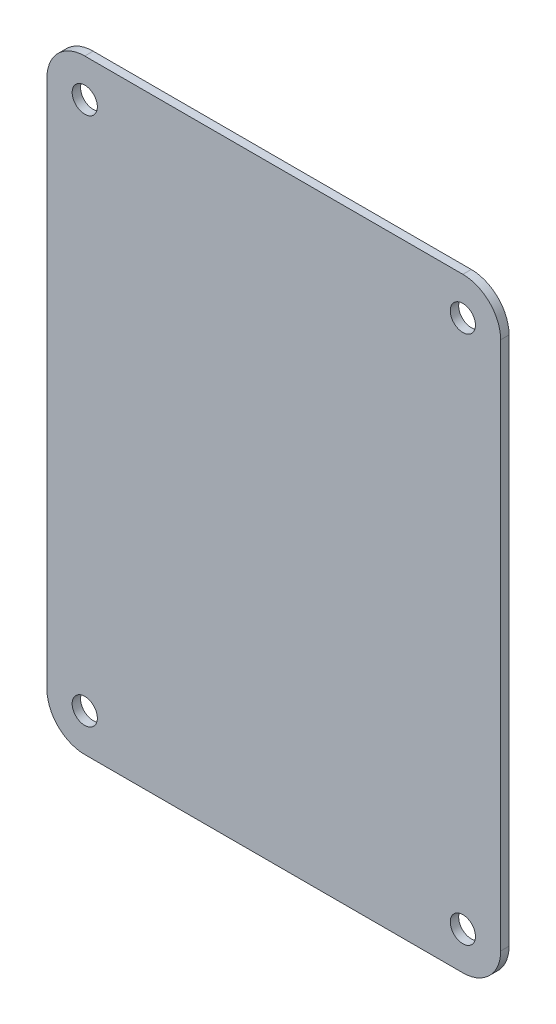
from build123d import *

# Parameters (mm, degrees)
MODEL_R                 = 1.5
SALIENTE_EXTRUIR1_DEPTH = 1


with BuildPart() as part:
    # Model → Saliente-Extruir1 (new body)
    with BuildSketch(Plane.XY):
        with BuildLine():
            Line((-105.943383637, 119.056539338), (-105.943383637, 56.056539338))
            ThreePointArc((-105.943383637, 56.056539338), (-104.625364152, 52.874558823), (-101.443383637, 51.556539338))
            Line((-101.443383637, 51.556539338), (-56.443383637, 51.556539338))
            ThreePointArc((-56.443383637, 51.556539338), (-53.261403122, 52.874558823), (-51.943383637, 56.056539338))
            Line((-51.943383637, 56.056539338), (-51.943383637, 119.056539338))
            ThreePointArc((-51.943383637, 119.056539338), (-53.261403122, 122.238519853), (-56.443383637, 123.556539338))
            Line((-56.443383637, 123.556539338), (-101.443383637, 123.556539338))
            ThreePointArc((-101.443383637, 123.556539338), (-104.625364152, 122.238519853), (-105.943383637, 119.056539338))
        make_face()
        with Locations((-101.443383637, 119.056539338)):
            Circle(MODEL_R, mode=Mode.SUBTRACT)
        with Locations((-56.443383637, 119.056539338)):
            Circle(MODEL_R, mode=Mode.SUBTRACT)
        with Locations((-101.443383637, 56.056539338)):
            Circle(MODEL_R, mode=Mode.SUBTRACT)
        with Locations((-56.443383637, 56.056539338)):
            Circle(MODEL_R, mode=Mode.SUBTRACT)
    extrude(amount=SALIENTE_EXTRUIR1_DEPTH)


solid = part.part
